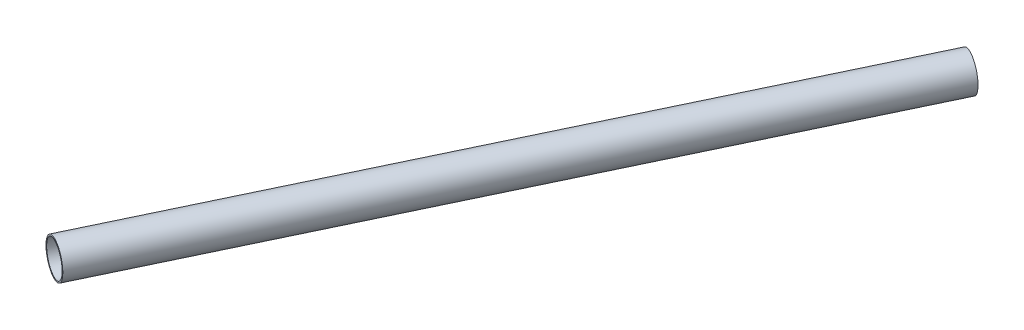
from build123d import *

# Parameters (mm, degrees)
SWEEP1_PROFILE_R     = 12.5
CUT_SWEEP1_PROFILE_R = 11.5


with BuildPart() as part:
    # Sweep1: sweep along a path in Sketch5
    with BuildLine(Plane(origin=(0, 0, 0), x_dir=(1, 0, 0), z_dir=(0, 1, 0))) as sweep1_path:
        Line((15.451096543, 110), (223.369661717, 546.088654867))
    # Sweep1 profile (on start of the path) → Sweep1 (sweep)
    with BuildSketch(Plane(origin=(15.451096543, 0, -110), x_dir=(-0.9026536814530927, 0, -0.43036766997438236), z_dir=(0.43036766997438236, 0, -0.9026536814530927))):
        Circle(SWEEP1_PROFILE_R)
    sweep(path=sweep1_path.line)

    # Cut-Sweep1: sweep along a path in Sketch5<2>
    with BuildLine(Plane(origin=(0, 0, 0), x_dir=(1, 0, 0), z_dir=(0, 1, 0))) as cut_sweep1_path:
        Line((15.451096543, 110), (223.369661717, 546.088654867))
    # Cut-Sweep1 profile (on start of the path) → Cut-Sweep1 (sweep, cut)
    with BuildSketch(Plane(origin=(15.451096543, 0, -110), x_dir=(-0.9026536814530927, 0, -0.43036766997438236), z_dir=(0.43036766997438236, 0, -0.9026536814530927))):
        Circle(CUT_SWEEP1_PROFILE_R)
    sweep(path=cut_sweep1_path.line, mode=Mode.SUBTRACT)


solid = part.part
